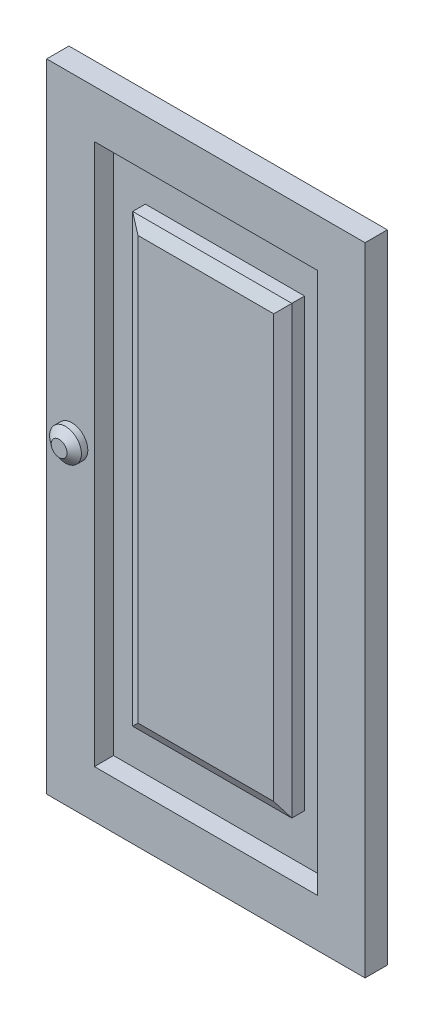
from build123d import *
from OCP.BRepFilletAPI import BRepFilletAPI_MakeChamfer

# Parameters (mm, degrees)
CROQUIS2_W              = 10
CROQUIS2_H              = 20
SALIENTE_EXTRUIR1_DEPTH = 0.7
CROQUIS3_W              = 7
CROQUIS3_H              = 17
CORTAR_EXTRUIR1_DEPTH   = 0.6
CROQUIS4_W              = 5
CROQUIS4_H              = 14
SALIENTE_EXTRUIR2_DEPTH = 0.6
CHAFL_N1_SIZE           = 0.2
CHAFL_N1_SIZE2          = 0.368354177
CROQUIS5_R              = 0.5
SALIENTE_EXTRUIR3_DEPTH = 0.4
CHAFL_N2_SIZE           = 0.2
CHAFL_N2_SIZE2          = 0.25143446


with BuildPart() as part:
    # Croquis2 → Saliente-Extruir1 (new body)
    with BuildSketch(Plane.XY):
        Rectangle(CROQUIS2_W, CROQUIS2_H)
    extrude(amount=SALIENTE_EXTRUIR1_DEPTH)

    # Croquis3 → Cortar-Extruir1 (cut)
    with BuildSketch(Plane.XY.offset(0.7)):
        Rectangle(CROQUIS3_W, CROQUIS3_H)
    extrude(amount=-CORTAR_EXTRUIR1_DEPTH, mode=Mode.SUBTRACT)

    # Croquis4 → Saliente-Extruir2 (add)
    with BuildSketch(Plane.XY.offset(0.1)):
        Rectangle(CROQUIS4_W, CROQUIS4_H)
    extrude(amount=SALIENTE_EXTRUIR2_DEPTH)

    # Chaflán1: one chamfer whose edges measure the first distance from different faces: ONE call of the kernel's chamfer builder (chamfer() names one face for all edges)
    chafl_n1_edges_1 = [part.edges().sort_by_distance(p)[0] for p in [
        (2.5, 0, 0.7),
    ]]
    chafl_n1_side_1 = [part.faces().sort_by_distance(p)[0] for p in [
        (2.5, 0, 0.4),
    ]]
    chafl_n1_edges_2 = [part.edges().sort_by_distance(p)[0] for p in [
        (0, 7, 0.7),
    ]]
    chafl_n1_side_2 = [part.faces().sort_by_distance(p)[0] for p in [
        (0, 7, 0.4),
    ]]
    chafl_n1_edges_3 = [part.edges().sort_by_distance(p)[0] for p in [
        (-2.5, 0, 0.7),
    ]]
    chafl_n1_side_3 = [part.faces().sort_by_distance(p)[0] for p in [
        (-2.5, 0, 0.4),
    ]]
    chafl_n1_edges_4 = [part.edges().sort_by_distance(p)[0] for p in [
        (0, -7, 0.7),
    ]]
    chafl_n1_side_4 = [part.faces().sort_by_distance(p)[0] for p in [
        (0, -7, 0.4),
    ]]
    chafl_n1 = BRepFilletAPI_MakeChamfer(part.part.solid().wrapped)
    for e in chafl_n1_edges_1:
        chafl_n1.Add(CHAFL_N1_SIZE, CHAFL_N1_SIZE2, e.wrapped, chafl_n1_side_1[0].wrapped)  # the first distance lies on this face
    for e in chafl_n1_edges_2:
        chafl_n1.Add(CHAFL_N1_SIZE, CHAFL_N1_SIZE2, e.wrapped, chafl_n1_side_2[0].wrapped)  # the first distance lies on this face
    for e in chafl_n1_edges_3:
        chafl_n1.Add(CHAFL_N1_SIZE, CHAFL_N1_SIZE2, e.wrapped, chafl_n1_side_3[0].wrapped)  # the first distance lies on this face
    for e in chafl_n1_edges_4:
        chafl_n1.Add(CHAFL_N1_SIZE, CHAFL_N1_SIZE2, e.wrapped, chafl_n1_side_4[0].wrapped)  # the first distance lies on this face
    add(Compound.cast(chafl_n1.Shape()), mode=Mode.REPLACE)

    # Croquis5 → Saliente-Extruir3 (add)
    with BuildSketch(Plane.XY.offset(0.7)):
        with Locations(Location((-4.208071118, 0, 0), (0, 0, 180))):
            Circle(CROQUIS5_R)
    extrude(amount=SALIENTE_EXTRUIR3_DEPTH)

    # Chaflán2
    chafl_n2_edges = [part.edges().sort_by_distance(p)[0] for p in [
        (-3.708071118, 0, 1.1),
    ]]
    chafl_n2_side = [part.faces().sort_by_distance(p)[0] for p in [
        (-3.708071118, 0, 0.9),
    ]]
    chamfer(chafl_n2_edges, length=CHAFL_N2_SIZE, length2=CHAFL_N2_SIZE2, reference=chafl_n2_side[0])


solid = part.part
